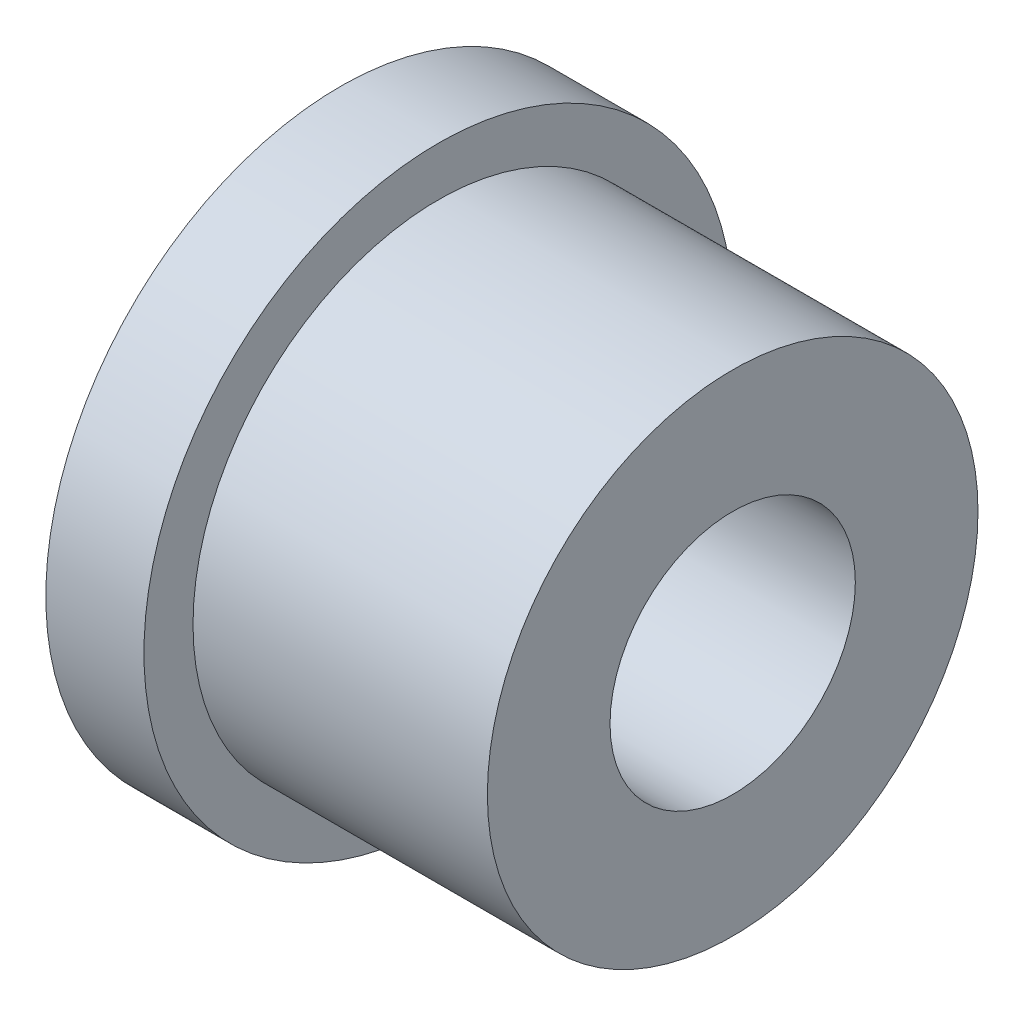
from build123d import *

# Parameters (mm, degrees)
SKETCH1_R           = 6
SKETCH1_R_2         = 2.5
BOSS_EXTRUDE1_DEPTH = 2
SKETCH2_R           = 5
SKETCH2_R_2         = 2.5
BOSS_EXTRUDE2_DEPTH = 6


with BuildPart() as part:
    # Sketch1 → Boss-Extrude1 (new body)
    with BuildSketch(Plane(origin=(0, 0, 0), x_dir=(0, 0, -1), z_dir=(1, 0, 0))):
        Circle(SKETCH1_R)
        Circle(SKETCH1_R_2, mode=Mode.SUBTRACT)
    extrude(amount=BOSS_EXTRUDE1_DEPTH)

    # Sketch2 → Boss-Extrude2 (add)
    with BuildSketch(Plane(origin=(2, 0, 0), x_dir=(0, 0, -1), z_dir=(1, 0, 0))):
        Circle(SKETCH2_R)
        Circle(SKETCH2_R_2, mode=Mode.SUBTRACT)
    extrude(amount=BOSS_EXTRUDE2_DEPTH)


solid = part.part
